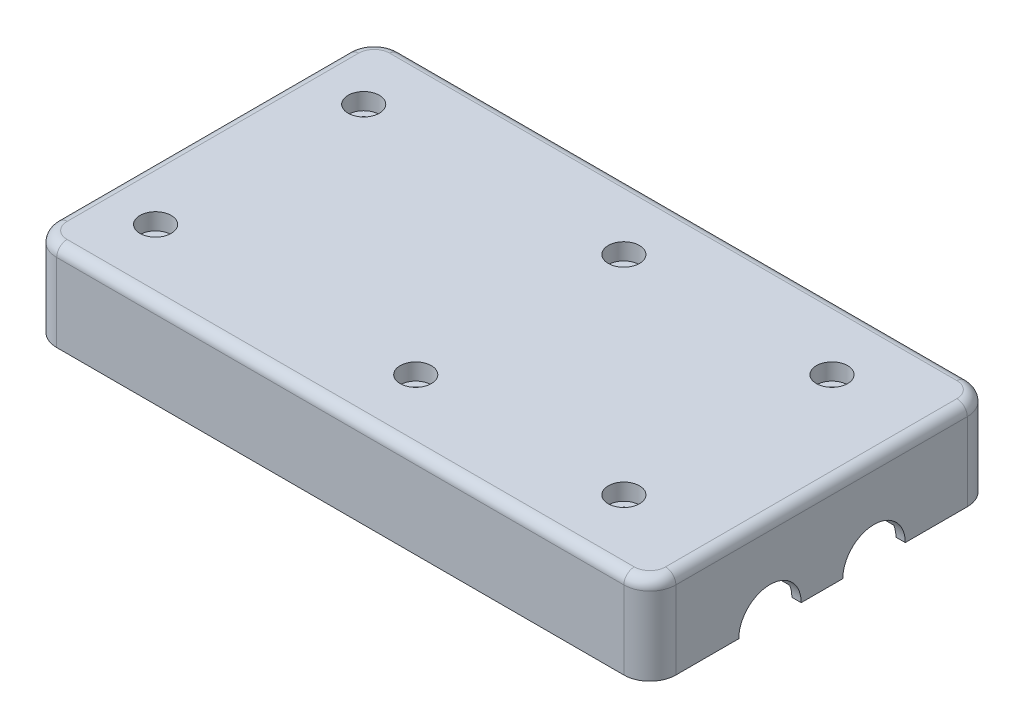
from build123d import *

# Parameters (mm, degrees)
SKETCH1_W           = 107
SKETCH1_H           = 54
BOSS_EXTRUDE1_DEPTH = 13
CUT_EXTRUDE1_DEPTH  = 2.2
BOSS_EXTRUDE2_DEPTH = 4
FILLET1_R           = 2
SKETCH4_R           = 6
CUT_EXTRUDE2_DEPTH  = 6
SKETCH6_R           = 7.226224696
CUT_EXTRUDE3_DEPTH  = 6
SKETCH9_R           = 4
SKETCH9_R_2         = 1.6
BOSS_EXTRUDE3_DEPTH = 9.75
SKETCH10_R          = 3
CUT_EXTRUDE5_DEPTH  = 3.2
SKETCH10_3_R        = 1.6
CUT_EXTRUDE6_DEPTH  = 71.130236122


with BuildPart() as part:
    # Sketch1 → Boss-Extrude1 (new body)
    with BuildSketch(Plane(origin=(0, 7.25, 0), x_dir=(1, 0, 0), z_dir=(0, 1, 0))):
        with BuildLine():
            Line((-54.5, -33), (54.5, -33))
            ThreePointArc((54.5, -33), (58.035533906, -31.535533906), (59.5, -28))
            Line((59.5, -28), (59.5, 28))
            ThreePointArc((59.5, 28), (58.035533906, 31.535533906), (54.5, 33))
            Line((54.5, 33), (-54.5, 33))
            ThreePointArc((-54.5, 33), (-58.035533906, 31.535533906), (-59.5, 28))
            Line((-59.5, 28), (-59.5, -28))
            ThreePointArc((-59.5, -28), (-58.035533906, -31.535533906), (-54.5, -33))
        make_face()
        Rectangle(SKETCH1_W, SKETCH1_H, mode=Mode.SUBTRACT)
    extrude(amount=BOSS_EXTRUDE1_DEPTH)

    # Sketch2 → Cut-Extrude1 (cut)
    with BuildSketch(Plane.XZ.offset(-7.25)):
        with BuildLine():
            Line((-52.7, -31.2), (52.7, -31.2))
            ThreePointArc((52.7, -31.2), (56.235533906, -29.735533906), (57.7, -26.2))
            Line((57.7, -26.2), (57.7, 26.2))
            ThreePointArc((57.7, 26.2), (56.235533906, 29.735533906), (52.7, 31.2))
            Line((52.7, 31.2), (-52.7, 31.2))
            ThreePointArc((-52.7, 31.2), (-56.235533906, 29.735533906), (-57.7, 26.2))
            Line((-57.7, 26.2), (-57.7, -26.2))
            ThreePointArc((-57.7, -26.2), (-56.235533906, -29.735533906), (-52.7, -31.2))
        make_face()
    extrude(amount=-CUT_EXTRUDE1_DEPTH, mode=Mode.SUBTRACT)

    # Sketch3 → Boss-Extrude2 (add)
    with BuildSketch(Plane(origin=(0, 20.25, 0), x_dir=(1, 0, 0), z_dir=(0, 1, 0))):
        with BuildLine():
            Line((-54.5, -33), (54.5, -33))
            ThreePointArc((54.5, -33), (58.035533906, -31.535533906), (59.5, -28))
            Line((59.5, -28), (59.5, 28))
            ThreePointArc((59.5, 28), (58.035533906, 31.535533906), (54.5, 33))
            Line((54.5, 33), (-54.5, 33))
            ThreePointArc((-54.5, 33), (-58.035533906, 31.535533906), (-59.5, 28))
            Line((-59.5, 28), (-59.5, -28))
            ThreePointArc((-59.5, -28), (-58.035533906, -31.535533906), (-54.5, -33))
        make_face()
    extrude(amount=BOSS_EXTRUDE2_DEPTH)

    # Fillet1
    fillet1_edges = [part.edges().sort_by_distance(p)[0] for p in [
        (-59.5, 24.25, 0),
        (-58.035533906, 24.25, -31.535533906),
        (0, 24.25, -33),
        (58.035533906, 24.25, -31.535533906),
        (59.5, 24.25, 0),
        (58.035533906, 24.25, 31.535533906),
        (0, 24.25, 33),
        (-58.035533906, 24.25, 31.535533906),
    ]]
    fillet(fillet1_edges, radius=FILLET1_R)

    # Sketch4 → Cut-Extrude2 (cut)
    with BuildSketch(Plane(origin=(59.5, 0, 0), x_dir=(0, 0, -1), z_dir=(1, 0, 0))):
        with Locations((-9.920000153, 7.26879997)):
            Circle(SKETCH4_R)
        with Locations((10.079999847, 7.26879997)):
            Circle(SKETCH4_R)
    extrude(amount=-CUT_EXTRUDE2_DEPTH, mode=Mode.SUBTRACT)

    # Sketch6 → Cut-Extrude3 (cut)
    with BuildSketch(Plane.ZY.offset(59.5)):
        with Locations((-6.1, 4.468799821)):
            Circle(SKETCH6_R)
        with BuildLine():
            Line((12, 14.25), (6, 14.25))
            ThreePointArc((6, 14.25), (3.878679656, 13.371320344), (3, 11.25))
            Line((3, 11.25), (3, 7.25))
            Line((3, 7.25), (15, 7.25))
            Line((15, 7.25), (15, 11.25))
            ThreePointArc((15, 11.25), (14.121320344, 13.371320344), (12, 14.25))
        make_face()
    extrude(amount=-CUT_EXTRUDE3_DEPTH, mode=Mode.SUBTRACT)

    # Sketch9 → Boss-Extrude3 (add)
    # profile 1 of 6: a face of its own
    with BuildSketch(Plane(origin=(0, 24.25, 0), x_dir=(1, 0, 0), z_dir=(0, 1, 0))):
        with Locations((-48.5, -20)):
            Circle(SKETCH9_R)
        with Locations((-48.5, -20)):
            Circle(SKETCH9_R_2, mode=Mode.SUBTRACT)
    # profile 2 of 6: a face of its own
    with BuildSketch(Plane(origin=(0, 24.25, 0), x_dir=(1, 0, 0), z_dir=(0, 1, 0))):
        with Locations((1.5, -20)):
            Circle(SKETCH9_R)
        with Locations((1.5, -20)):
            Circle(SKETCH9_R_2, mode=Mode.SUBTRACT)
    # profile 3 of 6: a face of its own
    with BuildSketch(Plane(origin=(0, 24.25, 0), x_dir=(1, 0, 0), z_dir=(0, 1, 0))):
        with Locations((41.5, -20)):
            Circle(SKETCH9_R)
        with Locations((41.5, -20)):
            Circle(SKETCH9_R_2, mode=Mode.SUBTRACT)
    # profile 4 of 6: a face of its own
    with BuildSketch(Plane(origin=(0, 24.25, 0), x_dir=(1, 0, 0), z_dir=(0, 1, 0))):
        with Locations((41.5, 20)):
            Circle(SKETCH9_R)
        with Locations((41.5, 20)):
            Circle(SKETCH9_R_2, mode=Mode.SUBTRACT)
    # profile 5 of 6: a face of its own
    with BuildSketch(Plane(origin=(0, 24.25, 0), x_dir=(1, 0, 0), z_dir=(0, 1, 0))):
        with Locations((1.5, 20)):
            Circle(SKETCH9_R)
        with Locations((1.5, 20)):
            Circle(SKETCH9_R_2, mode=Mode.SUBTRACT)
    # profile 6 of 6: a face of its own
    with BuildSketch(Plane(origin=(0, 24.25, 0), x_dir=(1, 0, 0), z_dir=(0, 1, 0))):
        with Locations((-48.5, 20)):
            Circle(SKETCH9_R)
        with Locations((-48.5, 20)):
            Circle(SKETCH9_R_2, mode=Mode.SUBTRACT)
    extrude(amount=-BOSS_EXTRUDE3_DEPTH)

    # Sketch10 → Cut-Extrude5 (cut)
    with BuildSketch(Plane(origin=(0, 24.25, 0), x_dir=(1, 0, 0), z_dir=(0, 1, 0))):
        with Locations((-48.5, 20)):
            Circle(SKETCH10_R)
        with Locations((1.5, 20)):
            Circle(SKETCH10_R)
        with Locations((41.5, 20)):
            Circle(SKETCH10_R)
        with Locations((41.5, -20)):
            Circle(SKETCH10_R)
        with Locations((1.5, -20)):
            Circle(SKETCH10_R)
        with Locations((-48.5, -20)):
            Circle(SKETCH10_R)
    extrude(amount=-CUT_EXTRUDE5_DEPTH, mode=Mode.SUBTRACT)

    # Sketch10<3> → Cut-Extrude6 (cut, through all)
    with BuildSketch(Plane(origin=(0, 24.25, 0), x_dir=(1, 0, 0), z_dir=(0, 1, 0))):
        with Locations((-48.5, 20)):
            Circle(SKETCH10_3_R)
        with Locations((1.5, 20)):
            Circle(SKETCH10_3_R)
        with Locations((41.5, 20)):
            Circle(SKETCH10_3_R)
        with Locations((41.5, -20)):
            Circle(SKETCH10_3_R)
        with Locations((1.5, -20)):
            Circle(SKETCH10_3_R)
        with Locations((-48.5, -20)):
            Circle(SKETCH10_3_R)
    extrude(amount=-CUT_EXTRUDE6_DEPTH, mode=Mode.SUBTRACT)


solid = part.part
